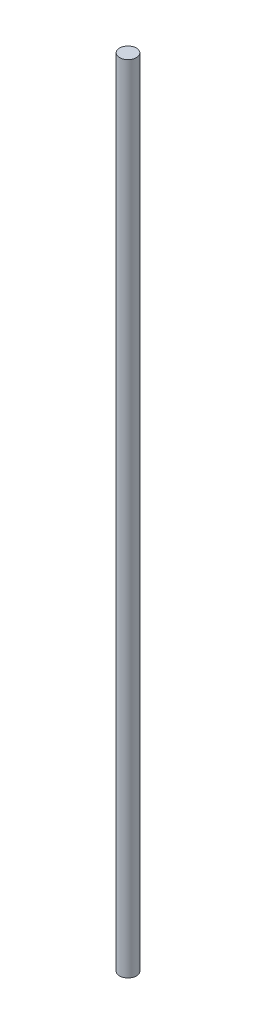
from build123d import *

# Parameters (mm, degrees)
SKETCH1_R           = 3
BOSS_EXTRUDE1_DEPTH = 285


with BuildPart() as part:
    # Sketch1 → Boss-Extrude1 (new body)
    with BuildSketch(Plane(origin=(0, 0, 0), x_dir=(1, 0, 0), z_dir=(0, 1, 0))):
        with Locations(Location((0, 0, 0), (0, 0, 270))):
            Circle(SKETCH1_R)
    extrude(amount=BOSS_EXTRUDE1_DEPTH)


solid = part.part
